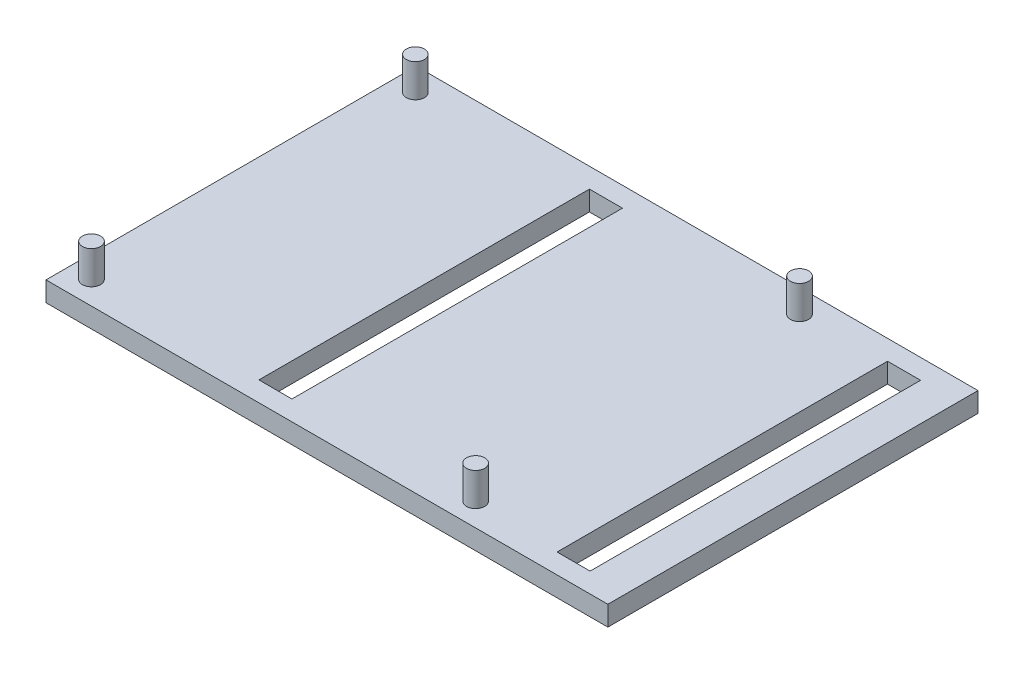
from build123d import *

# Parameters (mm, degrees)
ESQUISSE1_W             = 85
ESQUISSE1_H             = 56
ESQUISSE1_W_2           = 5
ESQUISSE1_H_2           = 50
BASE_DEPTH              = 3
ESQUISSE2_R             = 1.375
BOSS_ENTRETOISE_DEPTH   = 5
ESQUISSE3_R             = 1.375
ENL_V_MAT_EXTRU_1_DEPTH = 3


with BuildPart() as part:
    # Esquisse1 → BASE (new body)
    with BuildSketch(Plane(origin=(0, 0, 0), x_dir=(1, 0, 0), z_dir=(0, 1, 0))):
        Rectangle(ESQUISSE1_W, ESQUISSE1_H)
        with Locations((-10.787560704, 0)):
            Rectangle(ESQUISSE1_W_2, ESQUISSE1_H_2, mode=Mode.SUBTRACT)
        with Locations((34.31333568, 0)):
            Rectangle(ESQUISSE1_W_2, ESQUISSE1_H_2, mode=Mode.SUBTRACT)
    extrude(amount=BASE_DEPTH)

    # Esquisse2 → BOSS - ENTRETOISE (add)
    with BuildSketch(Plane(origin=(0, 3, 0), x_dir=(1, 0, 0), z_dir=(0, 1, 0))):
        with Locations(Location((-39.118286513, 24.5, 0), (0, 0, 90))):
            Circle(ESQUISSE2_R)
        with Locations(Location((-39.118286513, -24.5, 0), (0, 0, 90))):
            Circle(ESQUISSE2_R)
        with Locations(Location((19, 24.5, 0), (0, 0, 90))):
            Circle(ESQUISSE2_R)
        with Locations(Location((19, -24.5, 0), (0, 0, 90))):
            Circle(ESQUISSE2_R)
    extrude(amount=BOSS_ENTRETOISE_DEPTH)

    # Esquisse3 → Enlèv. mat.-Extru.1 (cut)
    with BuildSketch(Plane.XZ):
        with Locations(Location((19, 24.5, 0), (0, 0, 270))):
            Circle(ESQUISSE3_R)
        with Locations(Location((19, -24.5, 0), (0, 0, 270))):
            Circle(ESQUISSE3_R)
        with Locations(Location((-39.118286513, -24.5, 0), (0, 0, 270))):
            Circle(ESQUISSE3_R)
        with Locations(Location((-39.118286513, 24.5, 0), (0, 0, 270))):
            Circle(ESQUISSE3_R)
    extrude(amount=-ENL_V_MAT_EXTRU_1_DEPTH, mode=Mode.SUBTRACT)


with BuildPart() as enl_v_mat_extru_1_piece_1:
    # of the separate pieces the step leaves, piece 1, a body of its own (enl_v_mat_extru_1_pieces)
    add(part.part.solids().sort_by_distance((42.5, 0, -28))[0])

    # Esquisse4 → VIDE VIS 1 (revolve, cut)
    with BuildSketch(Plane.XY.offset(-24.5), mode=Mode.PRIVATE) as vide_vis_1_sk:
        Polygon((19, 2), (20.375, 2), (21.76, 0), (19, 0), align=None)
    vide_vis_1 = revolve(vide_vis_1_sk.sketch.rotate(Axis((19, 3, -24.5), (0, -1, 0)), 270), axis=Axis((19, 3, -24.5), (0, -1, 0)), mode=Mode.SUBTRACT)

    # Esquisse5 → VIDE VIS 2 (revolve, cut)
    with BuildSketch(Plane.XY.offset(-24.5), mode=Mode.PRIVATE) as vide_vis_2_sk:
        Polygon((-39.118286513, 2), (-37.743286513, 2), (-36.358286513, 0), (-39.118286513, 0), align=None)
    vide_vis_2 = revolve(vide_vis_2_sk.sketch.rotate(Axis((-39.118286513, 3, -24.5), (0, -1, 0)), 270), axis=Axis((-39.118286513, 3, -24.5), (0, -1, 0)), mode=Mode.SUBTRACT)

    # SYM VIS: VIDE VIS 1, VIDE VIS 2 across plane
    add(vide_vis_1.mirror(Plane.XY), mode=Mode.SUBTRACT)
    add(vide_vis_2.mirror(Plane.XY), mode=Mode.SUBTRACT)


with BuildPart() as enl_v_mat_extru_1_piece_2:
    # of the separate pieces the step leaves, piece 2, a body of its own (enl_v_mat_extru_1_pieces)
    add(part.part.solids().sort_by_distance((-39.118286513, 8, 23.125))[0])


with BuildPart() as enl_v_mat_extru_1_piece_3:
    # of the separate pieces the step leaves, piece 3, a body of its own (enl_v_mat_extru_1_pieces)
    add(part.part.solids().sort_by_distance((-39.118286513, 8, -25.875))[0])


with BuildPart() as enl_v_mat_extru_1_piece_4:
    # of the separate pieces the step leaves, piece 4, a body of its own (enl_v_mat_extru_1_pieces)
    add(part.part.solids().sort_by_distance((19, 8, -25.875))[0])


with BuildPart() as enl_v_mat_extru_1_piece_5:
    # of the separate pieces the step leaves, piece 5, a body of its own (enl_v_mat_extru_1_pieces)
    add(part.part.solids().sort_by_distance((19, 8, 23.125))[0])


solid = Compound([enl_v_mat_extru_1_piece_1.part, enl_v_mat_extru_1_piece_2.part, enl_v_mat_extru_1_piece_3.part, enl_v_mat_extru_1_piece_4.part, enl_v_mat_extru_1_piece_5.part])
